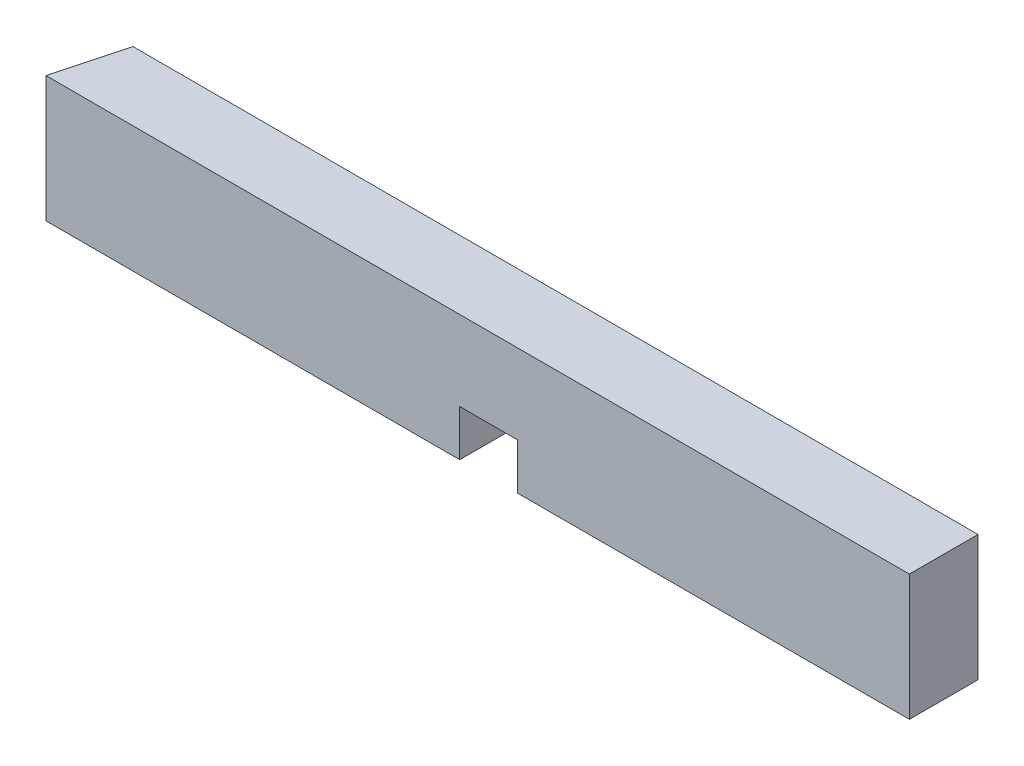
from build123d import *

# Parameters (mm, degrees)
CROQUIS1_W                 = 58.7375
CROQUIS1_H                 = 8.6614
SALIENTE_EXTRUIR1_DEPTH    = 4.7244
CORTAR_EXTRUIR2_DEPTH      = 60.560336732
CORTAR_EXTRUIR2_DEPTH_BACK = 60.560336732
CROQUIS2_W                 = 3.96875
CROQUIS2_H                 = 3.175
CORTAR_EXTRUIR4_DEPTH      = 60.560336732
SALIENTE_EXTRUIR2_DEPTH    = 8.6614


with BuildPart() as part:
    # Croquis1 → Saliente-Extruir1 (new body)
    with BuildSketch(Plane.XY):
        with Locations((29.36875, 4.3307)):
            Rectangle(CROQUIS1_W, CROQUIS1_H)
    extrude(amount=SALIENTE_EXTRUIR1_DEPTH)

    # Croquis2 → Cortar-Extruir2 (cut, two sides: drawn at the far end of the back side and taken through both)
    with BuildSketch(Plane.XY.offset(-CORTAR_EXTRUIR2_DEPTH_BACK)):
        with Locations((29.765625, 1.5875)):
            Rectangle(CROQUIS2_W, CROQUIS2_H)
    extrude(amount=CORTAR_EXTRUIR2_DEPTH + CORTAR_EXTRUIR2_DEPTH_BACK, mode=Mode.SUBTRACT)

    # Croquis4 → Cortar-Extruir4 (cut, through all)
    with BuildSketch(Plane(origin=(0, 8.6614, 0), x_dir=(1, 0, 0), z_dir=(0, 1, 0))):
        Polygon((0, -2.501152941), (0.5715, 0), (0, 0), align=None)
    extrude(amount=-CORTAR_EXTRUIR4_DEPTH, mode=Mode.SUBTRACT)

    # Croquis5 → Saliente-Extruir2 (add)
    with BuildSketch(Plane(origin=(0, 8.6614, 0), x_dir=(1, 0, 0), z_dir=(0, 1, 0))):
        Polygon((0.5715, 0), (-0.6985, -4.7244), (0.28575, -4.7244), align=None)
    extrude(amount=-SALIENTE_EXTRUIR2_DEPTH)


solid = part.part
